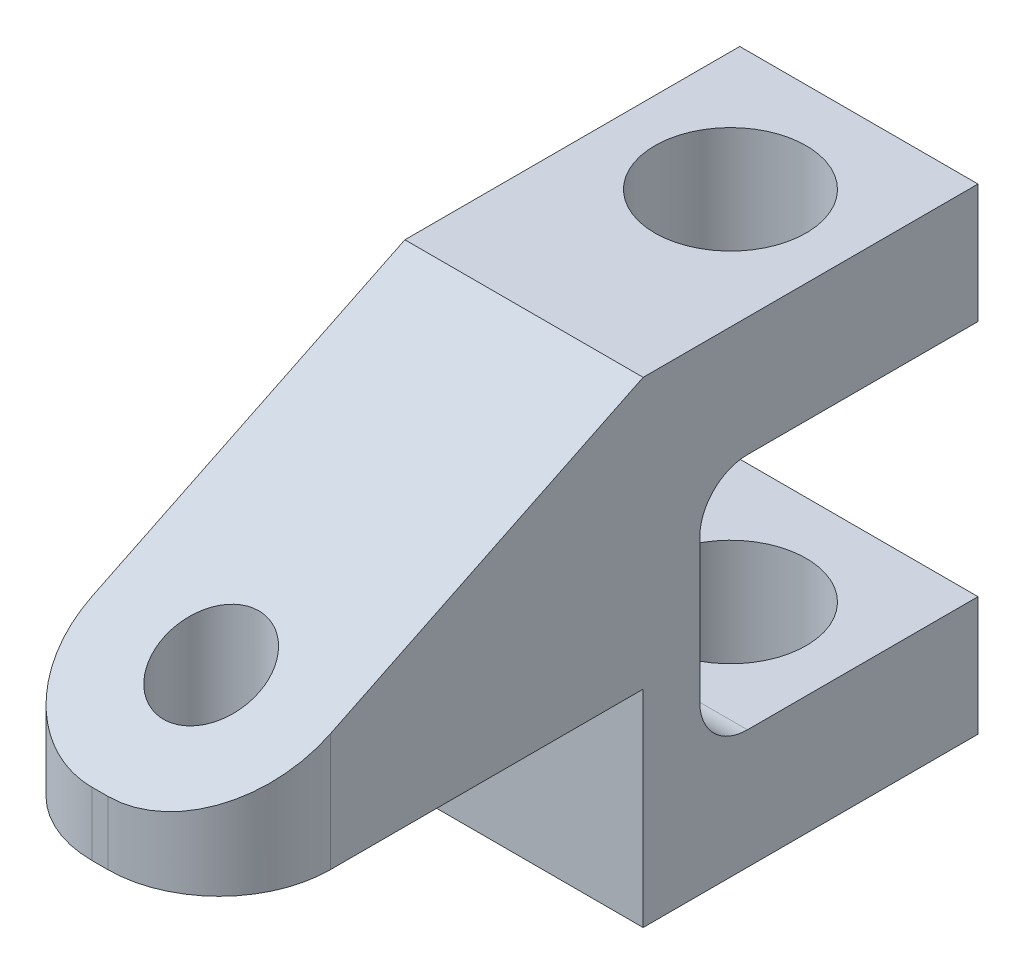
from build123d import *

# Parameters (mm, degrees)
SKETCH1_W                = 15
SKETCH1_H                = 47.7777777
BOSS_EXTRUDE1_DEPTH      = 4
BOSS_EXTRUDE3_DEPTH      = 13
BOSS_EXTRUDE3_DEPTH_BACK = 17
SKETCH10_W               = 15
SKETCH10_H               = 21.082393169
SKETCH11_W               = 17.516789228
SKETCH11_H               = 15
CUT_EXTRUDE4_DEPTH       = 33.934465389
SKETCH12_R               = 4.765
CUT_EXTRUDE5_DEPTH       = 40.075939022
FILLET3_R                = 3
BOSS_EXTRUDE5_DEPTH      = 15
CUT_EXTRUDE7_DEPTH       = 31.264319098
CUT_EXTRUDE7_DEPTH_BACK  = 31.264319098
SKETCH3_R                = 3
FILLET4_R                = 7


with BuildPart() as part:
    # Sketch1 → Boss-Extrude1 (new body)
    with BuildSketch(Plane(origin=(0, 0, 0), x_dir=(1, 0, 0), z_dir=(0, 1, 0))):
        Rectangle(SKETCH1_W, SKETCH1_H)
    extrude(amount=BOSS_EXTRUDE1_DEPTH)

    # Sketch10 → Boss-Extrude3 (add, two sides: drawn at the far end of the back side and taken through both)
    with BuildSketch(Plane(origin=(0, 4, 0), x_dir=(1, 0, 0), z_dir=(0, 1, 0)).offset(-BOSS_EXTRUDE3_DEPTH_BACK)):
        with Locations((0, 13.347692266)):
            Rectangle(SKETCH10_W, SKETCH10_H)
    extrude(amount=BOSS_EXTRUDE3_DEPTH + BOSS_EXTRUDE3_DEPTH_BACK)

    # Sketch11 → Cut-Extrude4 (cut, through all)
    with BuildSketch(Plane(origin=(7.5, 0, 0), x_dir=(0, 0, -1), z_dir=(1, 0, 0))):
        with Locations((15.130494236, 2)):
            Rectangle(SKETCH11_W, SKETCH11_H)
    extrude(amount=-CUT_EXTRUDE4_DEPTH, mode=Mode.SUBTRACT)

    # Sketch12 → Cut-Extrude5 (cut, through all)
    with BuildSketch(Plane(origin=(0, 17, 0), x_dir=(1, 0, 0), z_dir=(0, 1, 0))):
        with Locations(Location((0, 15.806495681, 0), (0, 0, 270))):
            Circle(SKETCH12_R)
    extrude(amount=-CUT_EXTRUDE5_DEPTH, mode=Mode.SUBTRACT)

    # Fillet3
    fillet3_edges = [part.edges().sort_by_distance(p)[0] for p in [
        (0, -5.5, -6.372099622),
        (0, 9.5, -6.372099622),
    ]]
    fillet(fillet3_edges, radius=FILLET3_R)

    # Sketch14 → Boss-Extrude5 (add)
    with BuildSketch(Plane(origin=(7.5, 0, 0), x_dir=(0, 0, -1), z_dir=(1, 0, 0))):
        Polygon((2.806495681, 17), (-23.88888885, 4), (2.806495681, 4), align=None)
    extrude(amount=-BOSS_EXTRUDE5_DEPTH)

    # Sketch3 → Cut-Extrude7 (cut, two sides: drawn at the far end of the back side and taken through both)
    with BuildSketch(Plane(origin=(0, 4, 0), x_dir=(1, 0, 0), z_dir=(0, 1, 0)).offset(-CUT_EXTRUDE7_DEPTH_BACK)):
        with Locations(Location((0, -16.88888885, 0), (0, 0, 90))):
            Circle(SKETCH3_R)
    extrude(amount=CUT_EXTRUDE7_DEPTH + CUT_EXTRUDE7_DEPTH_BACK, mode=Mode.SUBTRACT)

    # Fillet4
    fillet4_edges = [part.edges().sort_by_distance(p)[0] for p in [
        (7.5, 2, 23.88888885),
        (-7.5, 2, 23.88888885),
    ]]
    fillet(fillet4_edges, radius=FILLET4_R)


solid = part.part
